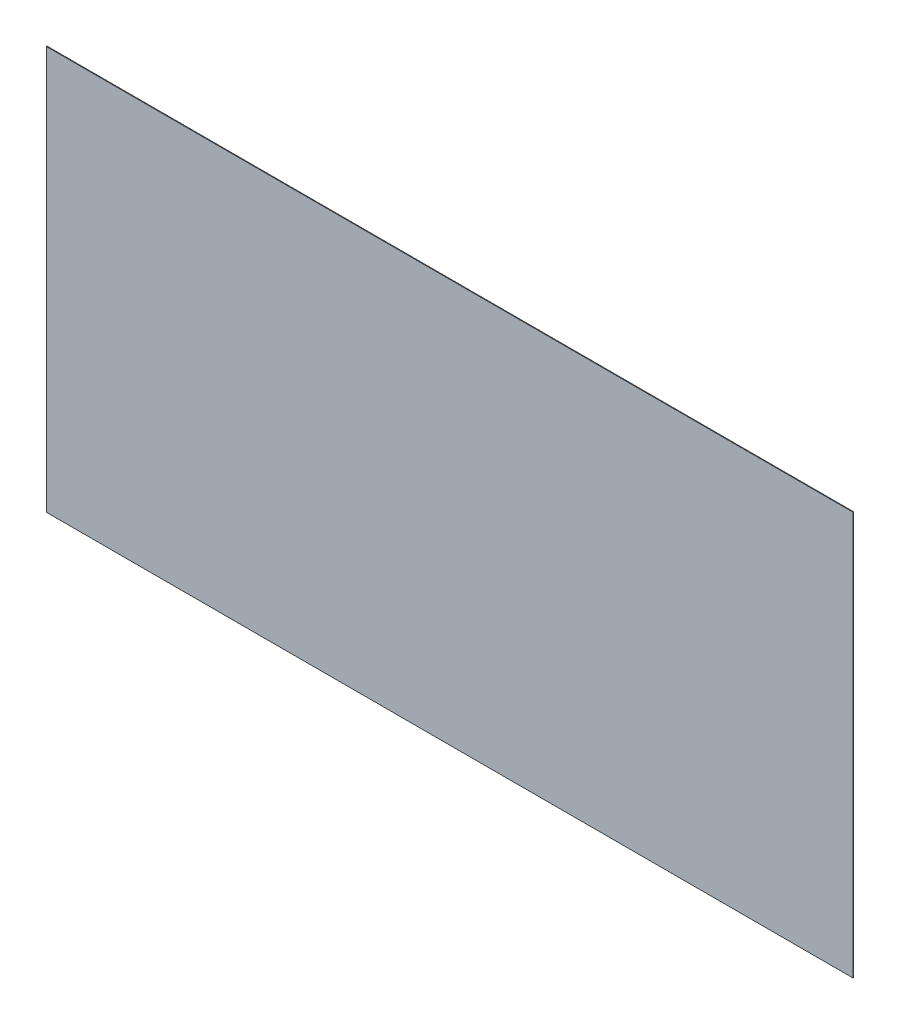
from build123d import *

# Parameters (mm, degrees)
BOSS_EXTRUDE1_DEPTH      = 0.79375
BOSS_EXTRUDE1_DEPTH_BACK = 0.79375
SKETCH1_W                = 1828.8
SKETCH1_H                = 914.4


with BuildPart() as part:
    # Sketch1 → Boss-Extrude1 (new, two sides: drawn at the far end of the back side and taken through both)
    with BuildSketch(Plane.XY.offset(-BOSS_EXTRUDE1_DEPTH_BACK)):
        Rectangle(SKETCH1_W, SKETCH1_H)
    extrude(amount=BOSS_EXTRUDE1_DEPTH + BOSS_EXTRUDE1_DEPTH_BACK)


solid = part.part
